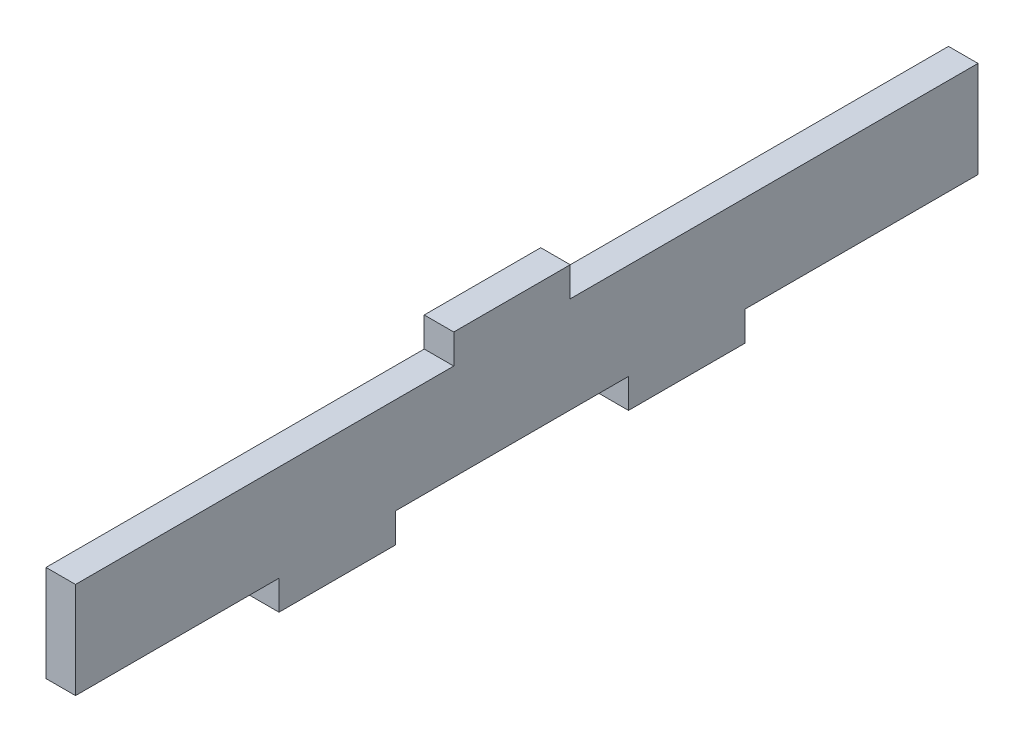
from build123d import *

# Parameters (mm, degrees)
SKETCH1_W               = 152.4
SKETCH1_H               = 25.4
BOSS_EXTRUDE1_DEPTH     = 4.826
SKETCH2_W               = 38.1
SKETCH2_H               = 4.826
BOTTOM_EDGE_SLOTS_DEPTH = 155.577521898
SKETCH4_W               = 66.675
SKETCH4_H               = 4.826
TOP_EDGE_SLOT_DEPTH     = 155.577521898
SKETCH6_W               = 4.826
SKETCH6_H               = 15.748
LEADING_EDGE_CUT_DEPTH  = 155.577521898


with BuildPart() as part:
    # Sketch1 → Boss-Extrude1 (new body)
    with BuildSketch(Plane(origin=(0, 0, 0), x_dir=(0, 0, -1), z_dir=(1, 0, 0))):
        with Locations((76.2, 12.7)):
            Rectangle(SKETCH1_W, SKETCH1_H)
    extrude(amount=BOSS_EXTRUDE1_DEPTH)

    # Sketch2 → Bottom Edge Slots (cut, through all)
    with BuildSketch(Plane(origin=(4.826, 0, 0), x_dir=(0, 0, -1), z_dir=(1, 0, 0))):
        with Locations((19.05, 2.413)):
            Rectangle(SKETCH2_W, SKETCH2_H)
        with Locations((76.2, 2.413)):
            Rectangle(SKETCH2_W, SKETCH2_H)
        with Locations((133.35, 2.413)):
            Rectangle(SKETCH2_W, SKETCH2_H)
    extrude(amount=-BOTTOM_EDGE_SLOTS_DEPTH, mode=Mode.SUBTRACT)

    # Sketch4 → Top Edge Slot (cut, through all)
    with BuildSketch(Plane(origin=(4.826, 0, 0), x_dir=(0, 0, -1), z_dir=(1, 0, 0))):
        with Locations((33.3375, 22.987)):
            Rectangle(SKETCH4_W, SKETCH4_H)
        with Locations((119.0625, 22.987)):
            Rectangle(SKETCH4_W, SKETCH4_H)
    extrude(amount=-TOP_EDGE_SLOT_DEPTH, mode=Mode.SUBTRACT)

    # Sketch6 → Leading Edge Cut (cut, through all)
    with BuildSketch(Plane(origin=(4.826, 0, 0), x_dir=(0, 0, -1), z_dir=(1, 0, 0))):
        with Locations((2.413, 12.7)):
            Rectangle(SKETCH6_W, SKETCH6_H)
    extrude(amount=-LEADING_EDGE_CUT_DEPTH, mode=Mode.SUBTRACT)


solid = part.part
